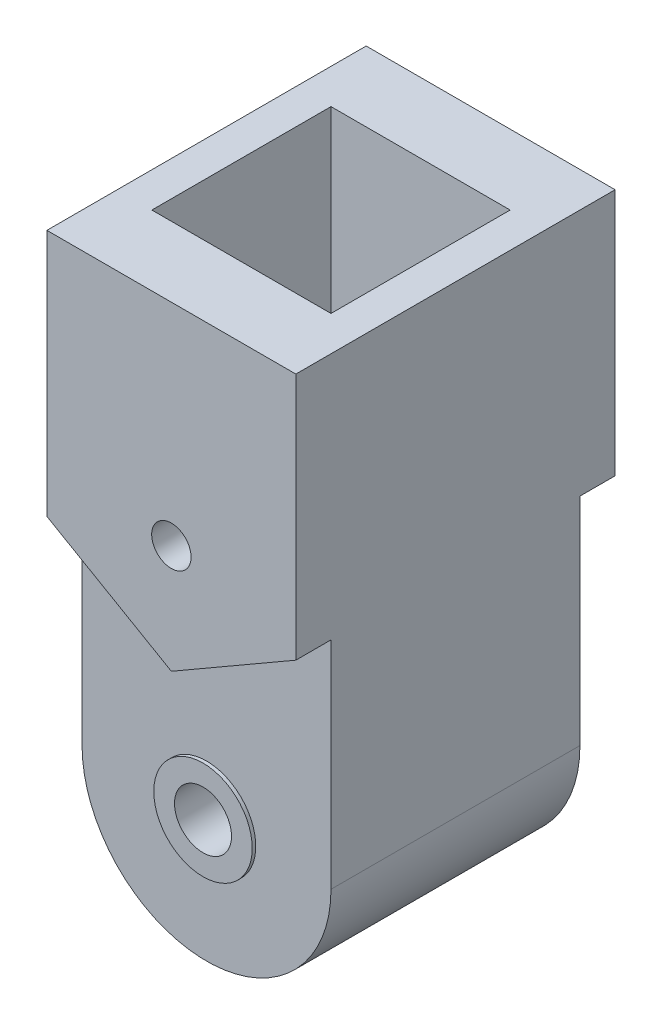
from build123d import *

# Parameters (mm, degrees)
SKETCH1_W           = 35.4
SKETCH1_H           = 35.4
SKETCH1_W_2         = 25.475
SKETCH1_H_2         = 25.475
BOSS_EXTRUDE1_DEPTH = 50.0375
SKETCH1_3_W         = 35.4
SKETCH1_3_H         = 35.4
SKETCH1_3_W_2       = 25.475
SKETCH1_3_H_2       = 25.475
BOSS_EXTRUDE2_DEPTH = 9.9625
SKETCH2_R           = 4.05
BOSS_EXTRUDE5_DEPTH = 35.4
SKETCH3_R           = 3.15
CUT_EXTRUDE1_DEPTH  = 88.31496149
SKETCH4_R           = 5.5
CUT_EXTRUDE2_DEPTH  = 25.6125
SKETCH5_R           = 7
SKETCH5_R_2         = 4.05
BOSS_EXTRUDE6_DEPTH = 0.5
BOSS_EXTRUDE7_DEPTH = 5
CUT_EXTRUDE3_REACH  = 69.006
SKETCH7_R           = 2.8


with BuildPart() as part:
    # Sketch1 → Boss-Extrude1 (new body)
    with BuildSketch(Plane(origin=(0, 0, 0), x_dir=(1, 0, 0), z_dir=(0, 1, 0))):
        Rectangle(SKETCH1_W, SKETCH1_H)
        Rectangle(SKETCH1_W_2, SKETCH1_H_2, mode=Mode.SUBTRACT)
    extrude(amount=BOSS_EXTRUDE1_DEPTH)

    # Sketch1<3> → Boss-Extrude2 (add)
    # profile 1 of 2: a face of its own
    with BuildSketch(Plane(origin=(0, 0, 0), x_dir=(1, 0, 0), z_dir=(0, 1, 0))):
        Rectangle(SKETCH1_3_W, SKETCH1_3_H)
        Rectangle(SKETCH1_3_W_2, SKETCH1_3_H_2, mode=Mode.SUBTRACT)
    # profile 2 of 2: a face of its own
    with BuildSketch(Plane(origin=(0, 0, 0), x_dir=(1, 0, 0), z_dir=(0, 1, 0))):
        Rectangle(SKETCH1_3_W_2, SKETCH1_3_H_2)
    extrude(amount=-BOSS_EXTRUDE2_DEPTH)

    # Sketch2 → Boss-Extrude5 (add)
    with BuildSketch(Plane.XY.offset(-17.7)):
        with BuildLine():
            Line((-17.7, -15.9125), (-17.7, -9.9625))
            Line((-17.7, -9.9625), (17.7, -9.9625))
            Line((17.7, -9.9625), (17.7, -15.9125))
            ThreePointArc((17.7, -15.9125), (0, -33.6125), (-17.7, -15.9125))
        make_face()
        with Locations(Location((0, -15.9625, 0), (0, 0, 180))):
            Circle(SKETCH2_R, mode=Mode.SUBTRACT)
    extrude(amount=BOSS_EXTRUDE5_DEPTH)

    # Sketch3 → Cut-Extrude1 (cut, through all)
    with BuildSketch(Plane(origin=(0, -33.6125, 0), x_dir=(-1, 0, 0), z_dir=(0, -1, 0))):
        with Locations(Location((0, 0, 0), (0, 0, 90))):
            Circle(SKETCH3_R)
    extrude(amount=-CUT_EXTRUDE1_DEPTH, mode=Mode.SUBTRACT)

    # Sketch4 → Cut-Extrude2 (cut)
    with BuildSketch(Plane(origin=(0, -33.6125, 0), x_dir=(-1, 0, 0), z_dir=(0, -1, 0))):
        with Locations(Location((0, 0, 0), (0, 0, 90))):
            Circle(SKETCH4_R)
    extrude(amount=-CUT_EXTRUDE2_DEPTH, mode=Mode.SUBTRACT)

    # Sketch5 → Boss-Extrude6 (add)
    with BuildSketch(Plane.XY.offset(17.7)):
        with Locations(Location((0, -15.9625, 0), (0, 0, 180))):
            Circle(SKETCH5_R)
        with Locations(Location((0, -15.9625, 0), (0, 0, 180))):
            Circle(SKETCH5_R_2, mode=Mode.SUBTRACT)
    boss_extrude6 = extrude(amount=BOSS_EXTRUDE6_DEPTH)

    # Mirror1: Boss-Extrude6 across plane
    add(boss_extrude6.mirror(Plane.XY))

    # Sketch6 → Boss-Extrude7 (add)
    with BuildSketch(Plane.XY.offset(17.7)):
        Polygon((0, 4.583434556), (17.7, 14.802534321), (17.7, 50.0375), (-17.7, 50.0375), (-17.7, 14.802534321), align=None)
    boss_extrude7 = extrude(amount=BOSS_EXTRUDE7_DEPTH)

    # Sketch7 → Cut-Extrude3 (cut, up to next)
    with BuildSketch(Plane.XY.offset(22.7), mode=Mode.PRIVATE) as cut_extrude3_sk1:
        with Locations((0, 20.0375)):
            Circle(SKETCH7_R)
    cut_extrude3_tool1 = extrude(cut_extrude3_sk1.sketch, amount=-CUT_EXTRUDE3_REACH, mode=Mode.PRIVATE) & part.part
    cut_extrude3 = cut_extrude3_tool1.solids().sort_by_distance((0, 20.0375, 22.7))[0]
    add(cut_extrude3, mode=Mode.SUBTRACT)

    # Mirror2: Boss-Extrude7, Cut-Extrude3 across plane
    add(boss_extrude7.mirror(Plane.XY))
    add(cut_extrude3.mirror(Plane.XY), mode=Mode.SUBTRACT)


solid = part.part
